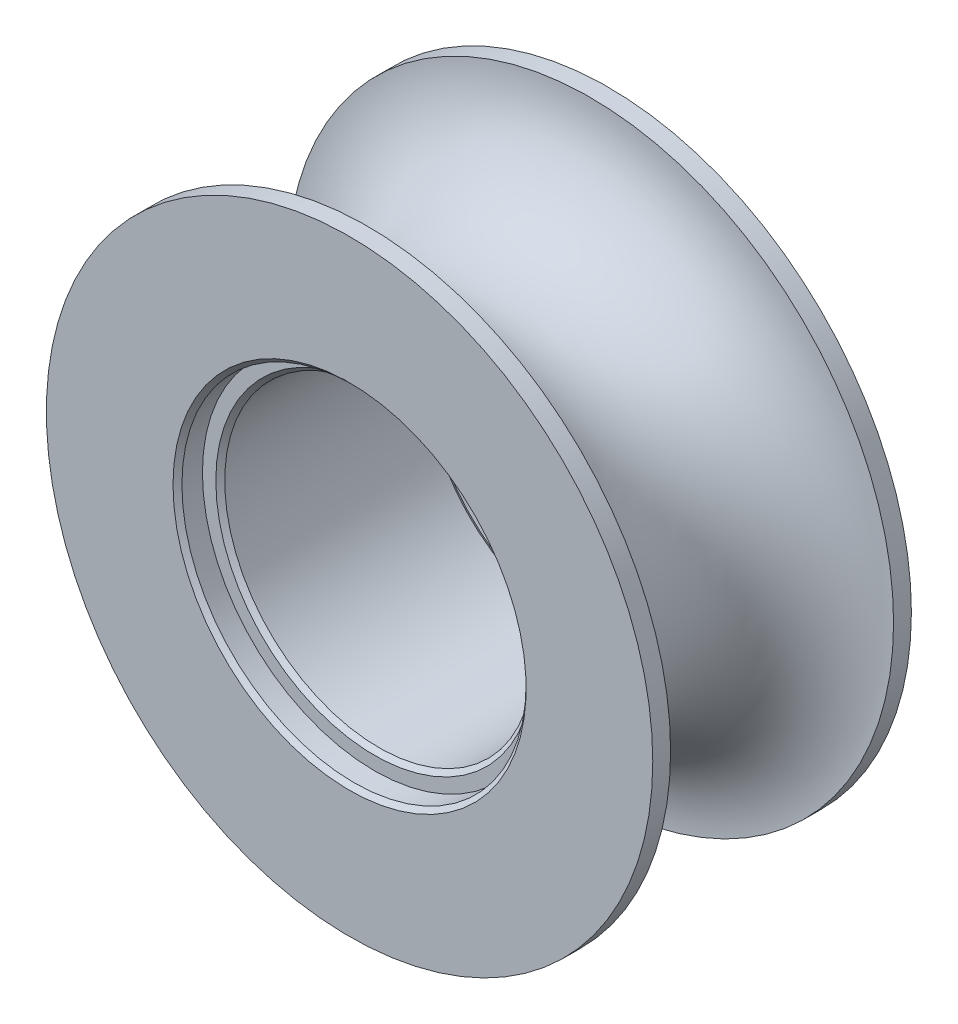
from build123d import *

# Parameters (mm, degrees)
SKETCH2_R          = 9.65
CUT_EXTRUDE1_DEPTH = 1.4
CUT_EXTRUDE2_START = -1.4
SKETCH3_R          = 9.65
CUT_EXTRUDE2_DEPTH = 1.4
CHAMFER1_SIZE      = 0.25


with BuildPart() as part:
    # Sketch1 → Revolve1 (revolve)
    with BuildSketch(Plane(origin=(0, 0, 0), x_dir=(0, 0, -1), z_dir=(1, 0, 0)), mode=Mode.PRIVATE) as revolve1_sk:
        with BuildLine():
            Line((-6.25, 17), (-7.25, 17))
            Line((-7.25, 17), (-7.25, 8.65))
            Line((-7.25, 8.65), (7.25, 8.65))
            Line((7.25, 8.65), (7.25, 17))
            Line((7.25, 17), (6.25, 17))
            ThreePointArc((6.25, 17), (0, 10.75), (-6.25, 17))
        make_face()
    revolve(revolve1_sk.sketch.rotate(Axis((0, 0, 64.980952982), (0, 0, -1)), 90), axis=Axis((0, 0, 64.980952982), (0, 0, -1)))

    # Sketch2 → Cut-Extrude1 (cut)
    with BuildSketch(Plane(origin=(0, 0, -7.25), x_dir=(-1, 0, 0), z_dir=(0, 0, -1))):
        Circle(SKETCH2_R)
    extrude(amount=-CUT_EXTRUDE1_DEPTH, mode=Mode.SUBTRACT)

    # Sketch3 → Cut-Extrude2 (cut)
    with BuildSketch(Plane.XY.offset(7.25).offset(CUT_EXTRUDE2_START)):
        with Locations(Location((0, 0, 0), (0, 0, 180))):
            Circle(SKETCH3_R)
    extrude(amount=CUT_EXTRUDE2_DEPTH, mode=Mode.SUBTRACT)

    # Chamfer1
    chamfer1_edges = [part.edges().sort_by_distance(p)[0] for p in [
        (9.65, 0, -7.25),
        (-8.65, 0, -5.85),
        (9.65, 0, 7.25),
        (-8.65, 0, 5.85),
    ]]
    chamfer(chamfer1_edges, length=CHAMFER1_SIZE)


solid = part.part
